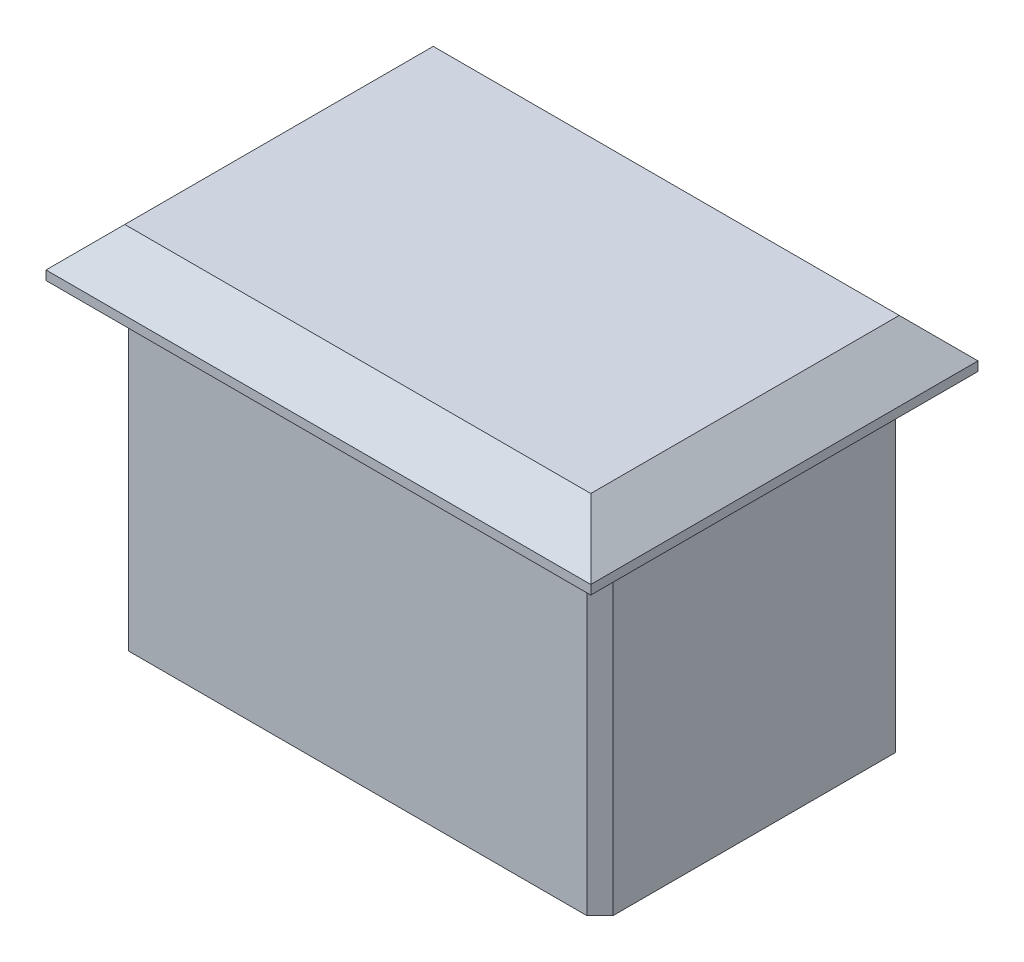
from build123d import *

# Parameters (mm, degrees)
SKETCH1_W           = 18.45
SKETCH1_H           = 11.75
BOSS_EXTRUDE1_DEPTH = 14
SKETCH2_W           = 20.75
SKETCH2_H           = 14.75
BOSS_EXTRUDE2_DEPTH = 1.85
CHAMFER1_SIZE       = 1.5
CHAMFER2_SIZE       = 0.5


with BuildPart() as part:
    # Sketch1 → Boss-Extrude1 (new body)
    with BuildSketch(Plane(origin=(0, 0, 0), x_dir=(1, 0, 0), z_dir=(0, 1, 0))):
        Rectangle(SKETCH1_W, SKETCH1_H)
    extrude(amount=BOSS_EXTRUDE1_DEPTH)

    # Sketch2 → Boss-Extrude2 (add)
    with BuildSketch(Plane(origin=(0, 14, 0), x_dir=(1, 0, 0), z_dir=(0, 1, 0))):
        Rectangle(SKETCH2_W, SKETCH2_H)
    extrude(amount=-BOSS_EXTRUDE2_DEPTH)

    # Chamfer1
    chamfer1_edges = [part.edges().sort_by_distance(p)[0] for p in [
        (-10.375, 14, 0),
        (0, 14, 7.375),
        (10.375, 14, 0),
        (0, 14, -7.375),
    ]]
    chamfer(chamfer1_edges, length=CHAMFER1_SIZE)

    # Chamfer2
    chamfer2_edges = [part.edges().sort_by_distance(p)[0] for p in [
        (-9.225, 6.075, -5.875),
        (9.225, 6.075, -5.875),
        (9.225, 6.075, 5.875),
        (-9.225, 6.075, 5.875),
    ]]
    chamfer(chamfer2_edges, length=CHAMFER2_SIZE)


solid = part.part
